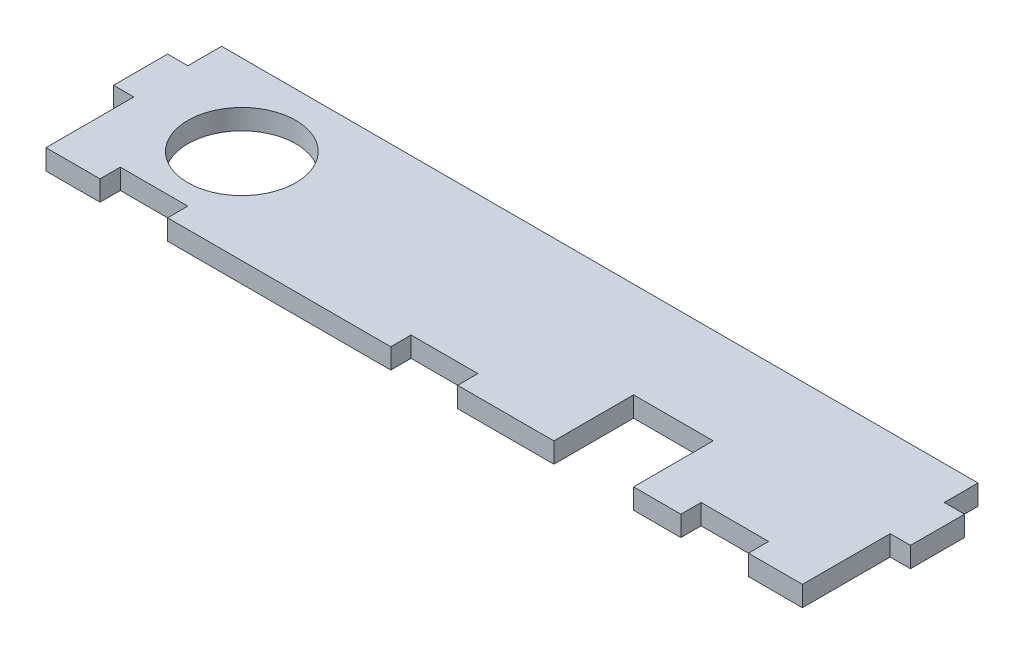
from build123d import *

# Parameters (mm, degrees)
SKETCH1_R           = 8
BOSS_EXTRUDE1_DEPTH = 3


with BuildPart() as part:
    # Sketch1 → Boss-Extrude1 (new body)
    with BuildSketch(Plane(origin=(0, 0, 0), x_dir=(1, 0, 0), z_dir=(0, 1, 0))):
        Polygon((1213.408125786, -2432.393668664), (1216.408125786, -2432.393668664), (1216.408125786, -2424.393668664), (1213.408125786, -2424.393668664), (1213.408125786, -2419.393668664), (1101.408125786, -2419.393668664), (1101.408125786, -2424.393668664), (1098.408125786, -2424.393668664), (1098.408125786, -2432.393668664), (1101.408125786, -2432.393668664), (1101.408125786, -2445.393668664), (1109.408125786, -2445.393668664), (1109.408125786, -2442.393668664), (1119.408125786, -2442.393668664), (1119.408125786, -2445.393668664), (1152.458125786, -2445.393668664), (1152.458125786, -2442.393668664), (1162.358125786, -2442.393668664), (1162.358125786, -2445.393668664), (1176.608125786, -2445.393668664), (1176.608125786, -2433.593668664), (1188.408125786, -2433.593668664), (1188.408125786, -2445.393668664), (1195.408125786, -2445.393668664), (1195.408125786, -2442.393668664), (1205.408125786, -2442.393668664), (1205.408125786, -2445.393668664), (1213.408125786, -2445.393668664), align=None)
        with Locations(Location((1116.408125786, -2431.393668664, 0), (0, 0, 270))):
            Circle(SKETCH1_R, mode=Mode.SUBTRACT)
    extrude(amount=BOSS_EXTRUDE1_DEPTH)


solid = part.part
